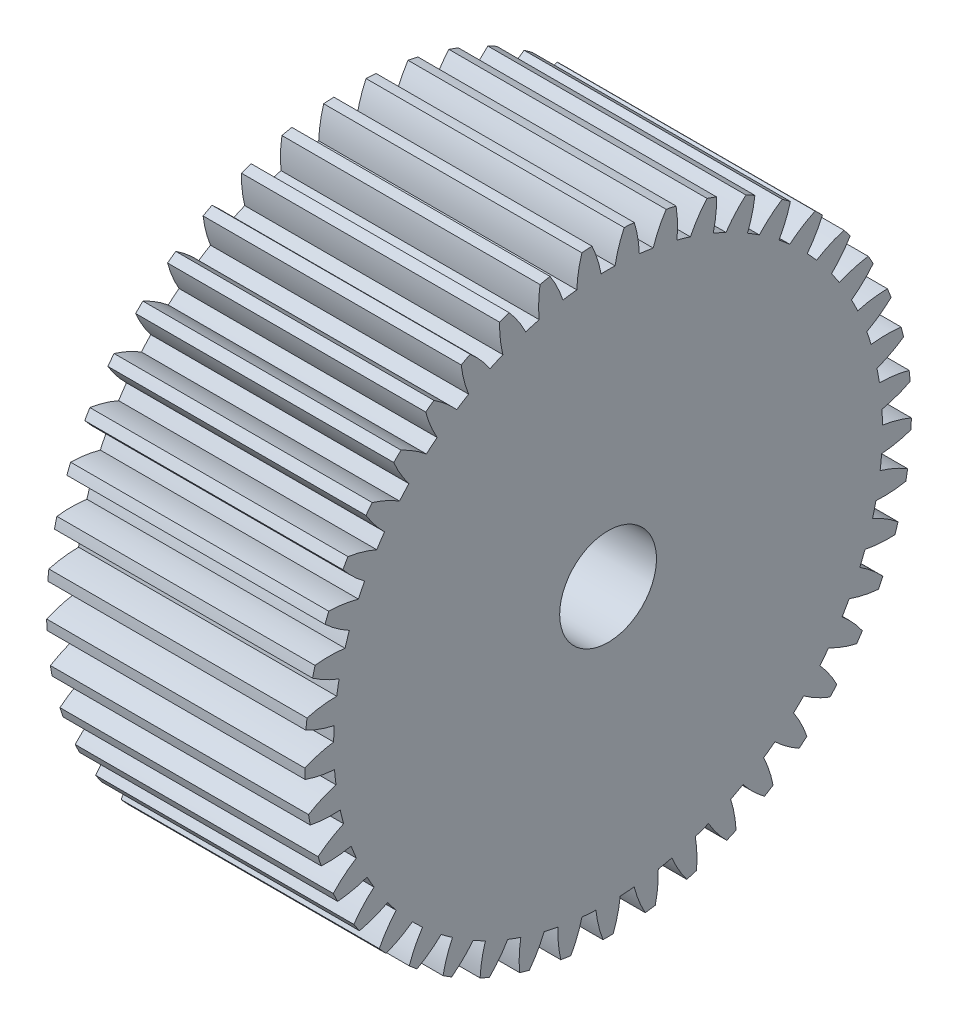
from build123d import *

# Parameters (mm, degrees)
BASPROSKE_W     = 25.4
BASPROSKE_H     = 29.845
TOOTHCUT_DEPTH  = 50.260613577
TEETHCUTS_COUNT = 45
TEETHCUTS_ANGLE = 352
BORSKE_R        = 4.7625
BORE_DEPTH      = 50.8000508


with BuildPart() as part:
    # BasProSke → Base-Revolve (revolve)
    with BuildSketch(Plane(origin=(0, 0, 0), x_dir=(1, 0, 0), z_dir=(0, 1, 0)), mode=Mode.PRIVATE) as base_revolve_sk:
        with Locations((12.7, 14.9225)):
            Rectangle(BASPROSKE_W, BASPROSKE_H)
    revolve(base_revolve_sk.sketch.rotate(Axis((-10, 0, 0), (1, 0, 0)), 180), axis=Axis((-10, 0, 0), (1, 0, 0)))

    # TooCutSke → ToothCut (cut, through all)
    with BuildSketch(Plane(origin=(0, 0, 0), x_dir=(0, 0, -1), z_dir=(1, 0, 0))):
        with BuildLine():
            ThreePointArc((0.687904372, 26.991435449), (0, 27.0002), (-0.687904372, 26.991435449))
            ThreePointArc((-0.687904372, 26.991435449), (-1.048670612, 28.439277252), (-1.594966091, 29.827787034))
            ThreePointArc((-1.594966091, 29.827787034), (0, 29.8704), (1.594966091, 29.827787034))
            ThreePointArc((1.594966091, 29.827787034), (1.048670612, 28.439277252), (0.687904372, 26.991435449))
        make_face()
    toothcut = extrude(amount=TOOTHCUT_DEPTH, mode=Mode.SUBTRACT)

    # TeethCuts: ToothCut ×45 about axis
    teethcuts_axis = Axis((-10, 0, 0), (1, 0, 0))
    for i in range(1, TEETHCUTS_COUNT):
        add(toothcut.rotate(teethcuts_axis, i * TEETHCUTS_ANGLE / (TEETHCUTS_COUNT - 1)), mode=Mode.SUBTRACT)

    # BorSke → Bore (cut, symmetric)
    with BuildSketch(Plane(origin=(0, 0, 0), x_dir=(0, 0, -1), z_dir=(1, 0, 0))):
        with Locations(Location((0, 0, 0), (0, 0, 180))):
            Circle(BORSKE_R)
    extrude(amount=BORE_DEPTH, both=True, mode=Mode.SUBTRACT)


solid = part.part
